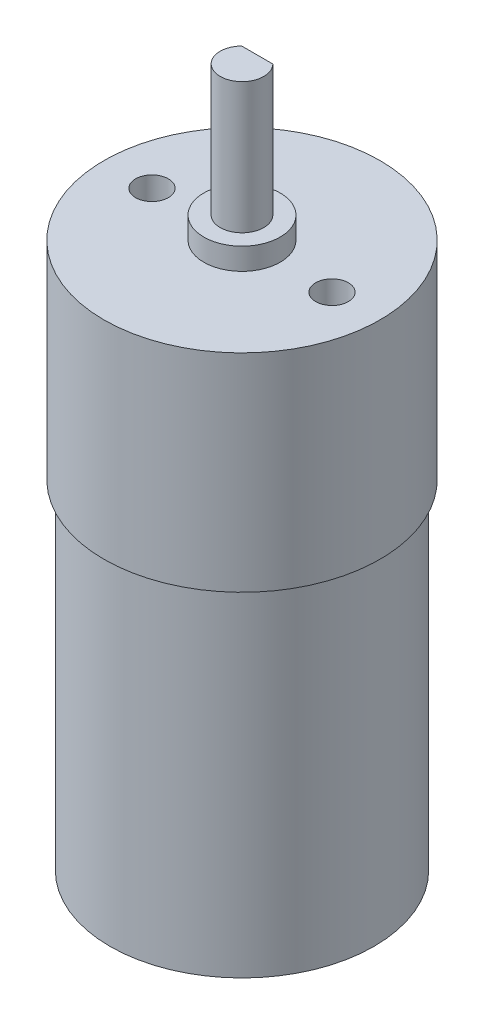
from build123d import *

# Parameters (mm, degrees)
SKETCH1_R           = 12.1
BOSS_EXTRUDE1_DEPTH = 31
SKETCH2_R           = 12.65
BOSS_EXTRUDE2_DEPTH = 19
SKETCH3_R           = 3.5
BOSS_EXTRUDE3_DEPTH = 2
SKETCH4_R           = 2
BOSS_EXTRUDE4_DEPTH = 12
SKETCH5_R           = 1.5
CUT_EXTRUDE1_DEPTH  = 6
CUT_EXTRUDE2_START  = -10
CUT_EXTRUDE2_DEPTH  = 10


with BuildPart() as part:
    # Sketch1 → Boss-Extrude1 (new body)
    with BuildSketch(Plane(origin=(0, 0, 0), x_dir=(1, 0, 0), z_dir=(0, 1, 0))):
        with Locations(Location((0, 0, 0), (0, 0, 270))):
            Circle(SKETCH1_R)
    extrude(amount=BOSS_EXTRUDE1_DEPTH)

    # Sketch2 → Boss-Extrude2 (add)
    with BuildSketch(Plane(origin=(0, 31, 0), x_dir=(1, 0, 0), z_dir=(0, 1, 0))):
        with Locations(Location((0, 0, 0), (0, 0, 270))):
            Circle(SKETCH2_R)
    extrude(amount=BOSS_EXTRUDE2_DEPTH)

    # Sketch3 → Boss-Extrude3 (add)
    with BuildSketch(Plane(origin=(0, 50, 0), x_dir=(1, 0, 0), z_dir=(0, 1, 0))):
        with Locations(Location((0, 0, 0), (0, 0, 270))):
            Circle(SKETCH3_R)
    extrude(amount=BOSS_EXTRUDE3_DEPTH)

    # Sketch4 → Boss-Extrude4 (add)
    with BuildSketch(Plane(origin=(0, 52, 0), x_dir=(1, 0, 0), z_dir=(0, 1, 0))):
        with Locations(Location((0, 0, 0), (0, 0, 270))):
            Circle(SKETCH4_R)
    extrude(amount=BOSS_EXTRUDE4_DEPTH)

    # Sketch5 → Cut-Extrude1 (cut)
    with BuildSketch(Plane(origin=(0, 50, 0), x_dir=(1, 0, 0), z_dir=(0, 1, 0))):
        with Locations(Location((8.25, 0, 0), (0, 0, 270))):
            Circle(SKETCH5_R)
        with Locations(Location((-8.25, 0, 0), (0, 0, 270))):
            Circle(SKETCH5_R)
    extrude(amount=-CUT_EXTRUDE1_DEPTH, mode=Mode.SUBTRACT)

    # Sketch6 → Cut-Extrude2 (cut)
    with BuildSketch(Plane(origin=(0, 64, 0), x_dir=(1, 0, 0), z_dir=(0, 1, 0)).offset(CUT_EXTRUDE2_START)):
        with BuildLine():
            Line((-1.428285686, 1.4), (1.428285686, 1.4))
            ThreePointArc((1.428285686, 1.4), (0, 2), (-1.428285686, 1.4))
        make_face()
    extrude(amount=CUT_EXTRUDE2_DEPTH, mode=Mode.SUBTRACT)


solid = part.part
